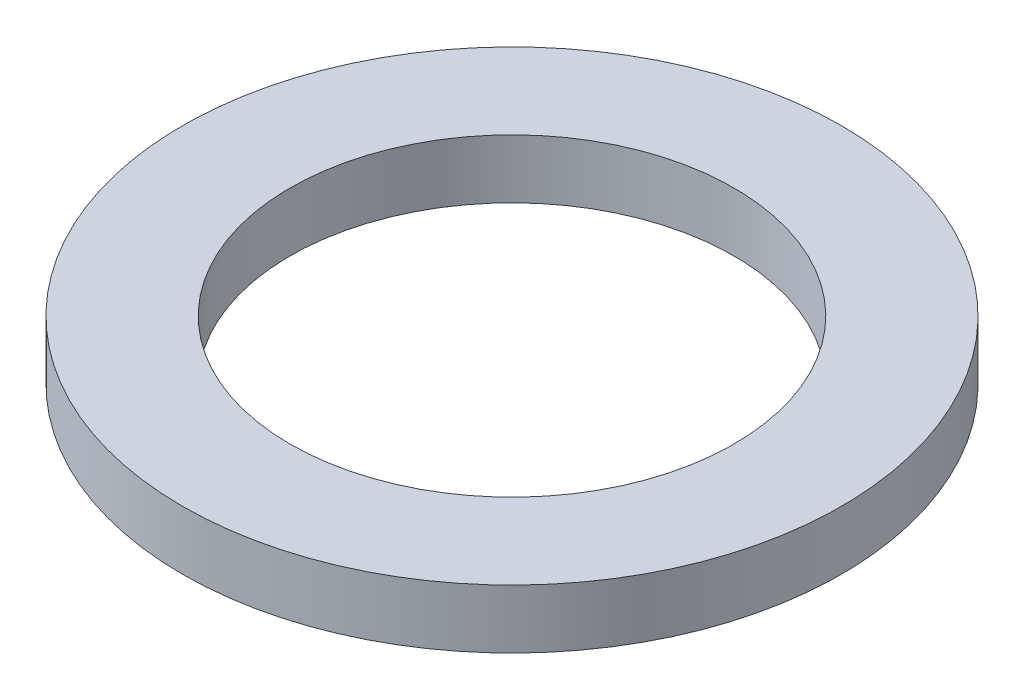
from build123d import *

# Parameters (mm, degrees)
SKETCH1_R           = 9.525
SKETCH1_R_2         = 6.4135
BOSS_EXTRUDE1_DEPTH = 1.7018


with BuildPart() as part:
    # Sketch1 → Boss-Extrude1 (new body)
    with BuildSketch(Plane(origin=(0, 0, 0), x_dir=(1, 0, 0), z_dir=(0, 1, 0))):
        with Locations(Location((0, 0, 0), (0, 0, 270))):
            Circle(SKETCH1_R)
        with Locations(Location((0, 0, 0), (0, 0, 270))):
            Circle(SKETCH1_R_2, mode=Mode.SUBTRACT)
    extrude(amount=BOSS_EXTRUDE1_DEPTH)


solid = part.part
